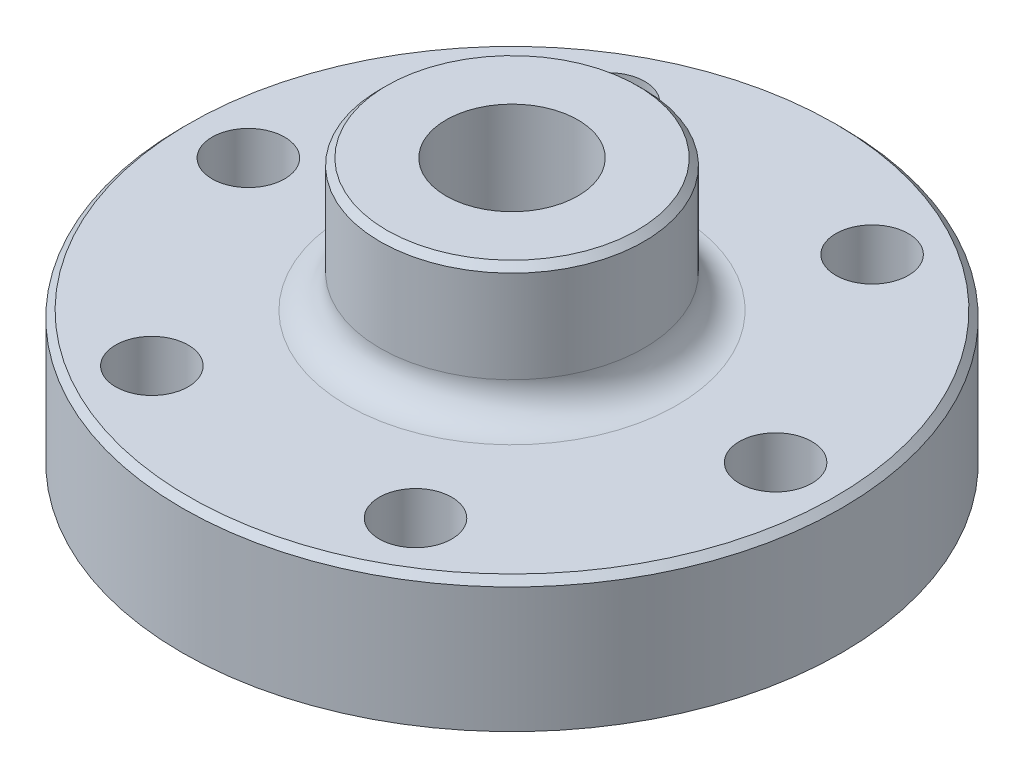
from build123d import *

# Parameters (mm, degrees)
SKETCH_2_R               = 1270
EXTRUDE_1_DEPTH          = 571.5
SKETCH_3_W               = 508
SKETCH_3_H               = 63.5
CHAMFER_2_SIZE           = 25.4
SKETCH_4_R               = 139.7
CUT_EXTRUDE_1_DEPTH      = 1016
EXTRUDE_START            = -2.54
SKETCH_5_R               = 508
EXTRUDE_2_DEPTH          = 508
FILLET_10_R              = 127
CHAMFER_3_SIZE           = 25.4
CUT_EXTRUDE_2_DEPTH      = 1886.556130589
CUT_EXTRUDE_2_DEPTH_BACK = 1886.556130589
SKETCH_6_R               = 254


with BuildPart() as part:
    # 草图2 → 凸台-拉伸1 (new body)
    with BuildSketch(Plane(origin=(0, 0, 0), x_dir=(1, 0, 0), z_dir=(0, 1, 0))):
        with Locations(Location((0, 0, 0), (0, 0, 270))):
            Circle(SKETCH_2_R)
    extrude(amount=EXTRUDE_1_DEPTH)

    # 草图3 → 切除-旋转1 (revolve, cut)
    with BuildSketch(Plane.XY, mode=Mode.PRIVATE) as cut_revolve_1_sk:
        with Locations((-1016, 31.75)):
            Rectangle(SKETCH_3_W, SKETCH_3_H)
    revolve(cut_revolve_1_sk.sketch.rotate(Axis((0, 0, 0), (0, -1, 0)), 270), axis=Axis((0, 0, 0), (0, -1, 0)), mode=Mode.SUBTRACT)

    # 倒角2
    chamfer_2_edges = [part.edges().sort_by_distance(p)[0] for p in [
        (0, 571.5, -1270),
    ]]
    chamfer(chamfer_2_edges, length=CHAMFER_2_SIZE)

    # 草图4 → 切除-拉伸1 (cut)
    with BuildSketch(Plane(origin=(0, 0, 0), x_dir=(1, 0, 0), z_dir=(0, 1, 0))):
        with Locations(Location((-507.739397927, 879.430434215, 0), (0, 0, 270))):
            Circle(SKETCH_4_R)
        with Locations(Location((507.739397927, 879.430434215, 0), (0, 0, 270))):
            Circle(SKETCH_4_R)
        with Locations(Location((1015.478795855, 0, 0), (0, 0, 270))):
            Circle(SKETCH_4_R)
        with Locations(Location((507.739397928, -879.430434215, 0), (0, 0, 270))):
            Circle(SKETCH_4_R)
        with Locations(Location((-507.739397927, -879.430434215, 0), (0, 0, 270))):
            Circle(SKETCH_4_R)
        with Locations(Location((-1015.478795855, 0, 0), (0, 0, 270))):
            Circle(SKETCH_4_R)
    extrude(amount=CUT_EXTRUDE_1_DEPTH, mode=Mode.SUBTRACT)

    # 草图5 → 凸台-拉伸2 (add)
    with BuildSketch(Plane(origin=(0, 574.04, 0), x_dir=(1, 0, 0), z_dir=(0, 1, 0)).offset(EXTRUDE_START)):
        with Locations(Location((0, 0, 0), (0, 0, 270))):
            Circle(SKETCH_5_R)
    extrude(amount=EXTRUDE_2_DEPTH)

    # 圆角10
    fillet_10_edges = [part.edges().sort_by_distance(p)[0] for p in [
        (0, 571.5, -508),
    ]]
    fillet(fillet_10_edges, radius=FILLET_10_R)

    # 倒角3
    chamfer_3_edges = [part.edges().sort_by_distance(p)[0] for p in [
        (0, 1079.5, -508),
    ]]
    chamfer(chamfer_3_edges, length=CHAMFER_3_SIZE)

    # 草图6 → 切除-拉伸2 (cut, two sides: drawn at the far end of the back side and taken through both)
    with BuildSketch(Plane(origin=(0, 574.04, 0), x_dir=(1, 0, 0), z_dir=(0, 1, 0)).offset(-CUT_EXTRUDE_2_DEPTH_BACK)):
        with Locations(Location((0, 0, 0), (0, 0, 270))):
            Circle(SKETCH_6_R)
    extrude(amount=CUT_EXTRUDE_2_DEPTH + CUT_EXTRUDE_2_DEPTH_BACK, mode=Mode.SUBTRACT)


solid = part.part
